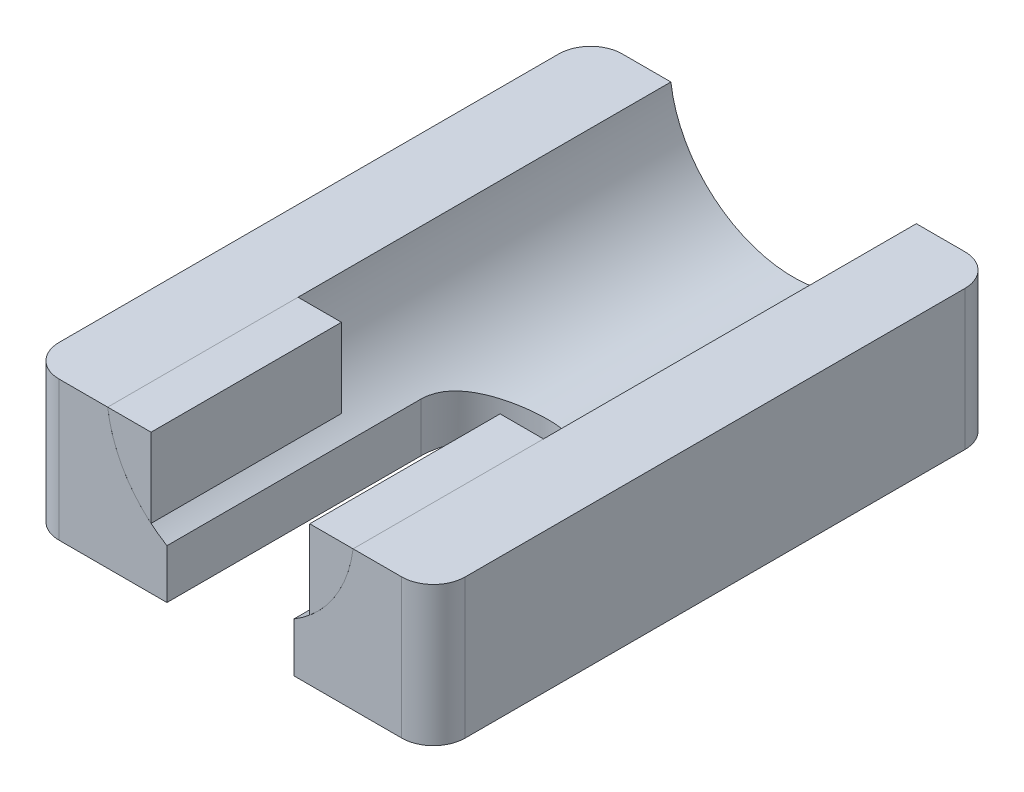
from build123d import *

# Parameters (mm, degrees)
SKETCH1_W             = 12.8
SKETCH1_H             = 9.8
SKETCH1_R             = 3.9
BOSS_EXTRUDE1_DEPTH   = 17.75
CUT_EXTRUDE4_DEPTH    = 10
BOSS_EXTRUDE3_DEPTH   = 6
BOSS_EXTRUDE3_2_DEPTH = 6
FILLET1_R             = 1
SKETCH10_W            = 12.8
SKETCH10_H            = 1
CUT_EXTRUDE5_DEPTH    = 20.494422395
SKETCH11_W            = 19.0923633
SKETCH11_H            = 7.42480795
CUT_EXTRUDE6_DEPTH    = 23.425710792


with BuildPart() as part:
    # Sketch1 → Boss-Extrude1 (new body)
    with BuildSketch(Plane.XY):
        Rectangle(SKETCH1_W, SKETCH1_H)
        Circle(SKETCH1_R, mode=Mode.SUBTRACT)
    extrude(amount=BOSS_EXTRUDE1_DEPTH)

    # Sketch6 → Cut-Extrude4 (cut)
    with BuildSketch(Plane(origin=(0, -4.9, 0), x_dir=(-1, 0, 0), z_dir=(0, -1, 0))):
        with BuildLine():
            Line((2, -9.75), (2, -17.75))
            ThreePointArc((2, -17.75), (0, -19.75), (-2, -17.75))
            Line((-2, -17.75), (-2, -9.75))
            ThreePointArc((-2, -9.75), (0, -7.75), (2, -9.75))
        make_face()
    extrude(amount=-CUT_EXTRUDE4_DEPTH, mode=Mode.SUBTRACT)

    # Fillet1
    fillet1_edges = [part.edges().sort_by_distance(p)[0] for p in [
        (6.4, 0, 17.75),
        (-6.4, 0, 17.75),
        (6.4, 0, 0),
        (-6.4, 0, 0),
    ]]
    fillet(fillet1_edges, radius=FILLET1_R)


with BuildPart() as body_2:
    # Sketch9 → Boss-Extrude3 (new body)
    with BuildSketch(Plane.XY.offset(17.75)):
        with BuildLine():
            Line((-2.5, 2.993325909), (-2.5, -2.993325909))
            ThreePointArc((-2.5, -2.993325909), (-3.9, 0), (-2.5, 2.993325909))
        make_face()
    extrude(amount=-BOSS_EXTRUDE3_DEPTH)


with BuildPart() as body_3:
    # Sketch9 → Boss-Extrude3 2 (new body)
    with BuildSketch(Plane.XY.offset(17.75)):
        with BuildLine():
            Line((2.5, 2.993325909), (2.5, -2.993325909))
            ThreePointArc((2.5, -2.993325909), (3.9, 0), (2.5, 2.993325909))
        make_face()
    extrude(amount=-BOSS_EXTRUDE3_2_DEPTH)


with BuildPart() as cut_extrude5_tool:
    # Sketch10 → Cut-Extrude5 (new, through all)
    with BuildSketch(Plane.XY.offset(17.75)):
        Rectangle(SKETCH10_W, SKETCH10_H)
    extrude(amount=-CUT_EXTRUDE5_DEPTH)


with BuildPart() as part_1:
    add(part.part)

    # Cut-Extrude5: cut by cut_extrude5_tool
    add(cut_extrude5_tool.part, mode=Mode.SUBTRACT)


with BuildPart() as body_2_1:
    add(body_2.part)

    # Cut-Extrude5: cut by cut_extrude5_tool
    add(cut_extrude5_tool.part, mode=Mode.SUBTRACT)


with BuildPart() as body_3_1:
    add(body_3.part)

    # Cut-Extrude5: cut by cut_extrude5_tool
    add(cut_extrude5_tool.part, mode=Mode.SUBTRACT)


with BuildPart() as cut_extrude5_piece_1:
    # of the separate pieces the step leaves, piece 1, a body of its own (cut_extrude5_pieces)
    add(part_1.part.solids().sort_by_distance((-5.4, -4.9, 0))[0])


with BuildPart() as cut_extrude5_piece_2:
    # of the separate pieces the step leaves, piece 2, a body of its own (cut_extrude5_pieces)
    add(part_1.part.solids().sort_by_distance((-5.4, 4.9, 0))[0])


with BuildPart() as cut_extrude5_piece_1_of_body_2:
    # of the separate pieces the step leaves, piece 1, a body of its own (cut_extrude5_pieces_of_body_2)
    add(body_2_1.part.solids().sort_by_distance((-2.5, -0.5, 17.75))[0])


with BuildPart() as cut_extrude5_piece_2_of_body_2:
    # of the separate pieces the step leaves, piece 2, a body of its own (cut_extrude5_pieces_of_body_2)
    add(body_2_1.part.solids().sort_by_distance((-2.5, 2.993325909, 17.75))[0])


with BuildPart() as cut_extrude5_piece_1_of_body_3:
    # of the separate pieces the step leaves, piece 1, a body of its own (cut_extrude5_pieces_of_body_3)
    add(body_3_1.part.solids().sort_by_distance((2.5, -0.5, 17.75))[0])


with BuildPart() as cut_extrude5_piece_2_of_body_3:
    # of the separate pieces the step leaves, piece 2, a body of its own (cut_extrude5_pieces_of_body_3)
    add(body_3_1.part.solids().sort_by_distance((2.5, 2.993325909, 17.75))[0])


with BuildPart() as cut_extrude6_tool:
    # Sketch11 → Cut-Extrude6 (new, through all)
    with BuildSketch(Plane(origin=(6.4, 0, 0), x_dir=(0, 0, -1), z_dir=(1, 0, 0))):
        with Locations((-8.735389822, 3.368397429)):
            Rectangle(SKETCH11_W, SKETCH11_H)
    extrude(amount=-CUT_EXTRUDE6_DEPTH)


with BuildPart() as cut_extrude5_piece_2_1:
    add(cut_extrude5_piece_2.part)

    # Cut-Extrude6: cut by cut_extrude6_tool
    add(cut_extrude6_tool.part, mode=Mode.SUBTRACT)


with BuildPart() as cut_extrude5_piece_2_of_body_2_1:
    add(cut_extrude5_piece_2_of_body_2.part)

    # Cut-Extrude6: cut by cut_extrude6_tool
    add(cut_extrude6_tool.part, mode=Mode.SUBTRACT)


with BuildPart() as cut_extrude5_piece_2_of_body_3_1:
    add(cut_extrude5_piece_2_of_body_3.part)

    # Cut-Extrude6: cut by cut_extrude6_tool
    add(cut_extrude6_tool.part, mode=Mode.SUBTRACT)


solid = Compound([cut_extrude5_piece_1.part, cut_extrude5_piece_1_of_body_2.part, cut_extrude5_piece_1_of_body_3.part])
